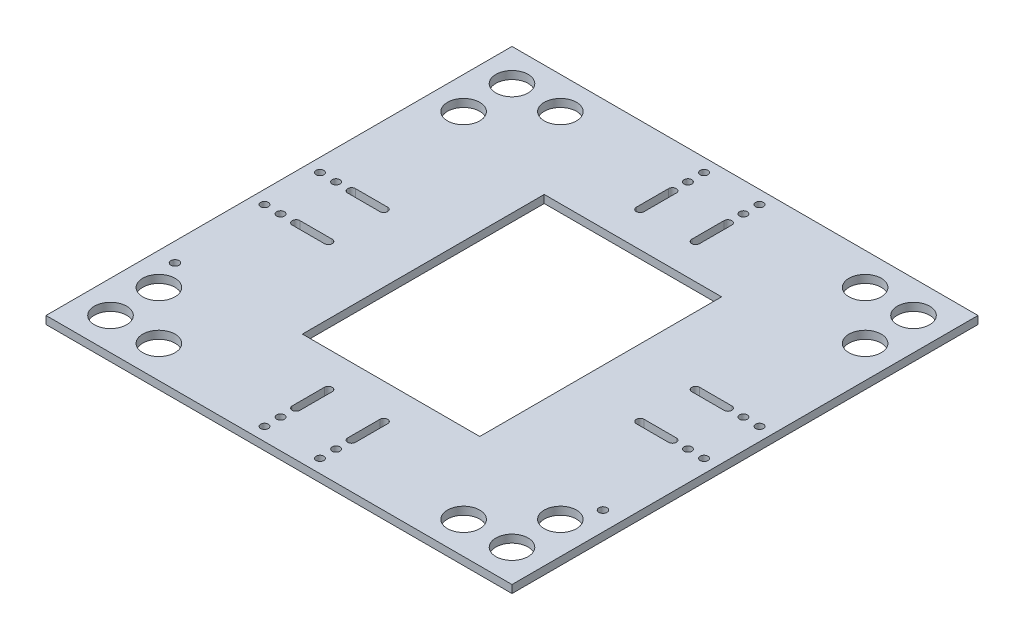
from build123d import *

# Parameters (mm, degrees)
SKETCH3_W           = 183.5200292
SKETCH3_H           = 183.5200292
BOSS_EXTRUDE1_DEPTH = 3.0988
SKETCH4_R           = 1.524
CUT_EXTRUDE1_DEPTH  = 260.555013045
CUT_EXTRUDE2_REACH  = 261.555
SKETCH5_R           = 6.35
SKETCH5_W           = 69.85
SKETCH5_H           = 95.25
SKETCH7_R           = 1.6002
CUT_EXTRUDE6_DEPTH  = 2.54


with BuildPart() as part:
    # Sketch3 → Boss-Extrude1 (new body)
    with BuildSketch(Plane(origin=(0, 0, 0), x_dir=(1, 0, 0), z_dir=(0, 1, 0))):
        with Locations((91.7600146, 91.7600146)):
            Rectangle(SKETCH3_W, SKETCH3_H)
    extrude(amount=BOSS_EXTRUDE1_DEPTH)

    # Sketch4 → Cut-Extrude1 (cut, through all)
    with BuildSketch(Plane(origin=(0, 3.0988, 0), x_dir=(1, 0, 0), z_dir=(0, 1, 0))):
        with Locations(Location((5.200015, 102.6820146, 0), (0, 0, 270))):
            Circle(SKETCH4_R)
        with Locations(Location((11.550015, 102.6820146, 0), (0, 0, 270))):
            Circle(SKETCH4_R)
        with Locations(Location((11.550015, 80.8380146, 0), (0, 0, 90))):
            Circle(SKETCH4_R)
        with Locations(Location((5.200015, 80.8380146, 0), (0, 0, 90))):
            Circle(SKETCH4_R)
        with Locations(Location((178.3200142, 80.8380146, 0), (0, 0, 270))):
            Circle(SKETCH4_R)
        with Locations(Location((171.9700142, 80.8380146, 0), (0, 0, 270))):
            Circle(SKETCH4_R)
        with Locations(Location((171.9700142, 102.6820146, 0), (0, 0, 90))):
            Circle(SKETCH4_R)
        with Locations(Location((178.3200142, 102.6820146, 0), (0, 0, 90))):
            Circle(SKETCH4_R)
        with Locations(Location((80.8380146, 178.3130292, 0), (0, 0, 270))):
            Circle(SKETCH4_R)
        with Locations(Location((80.8380146, 171.9630292, 0), (0, 0, 270))):
            Circle(SKETCH4_R)
        with Locations(Location((102.6820146, 171.9630292, 0), (0, 0, 90))):
            Circle(SKETCH4_R)
        with Locations(Location((102.6820146, 178.3130292, 0), (0, 0, 90))):
            Circle(SKETCH4_R)
        with Locations(Location((102.6820146, 5.207, 0), (0, 0, 270))):
            Circle(SKETCH4_R)
        with Locations(Location((102.6820146, 11.557, 0), (0, 0, 270))):
            Circle(SKETCH4_R)
        with Locations(Location((80.8380146, 11.557, 0), (0, 0, 90))):
            Circle(SKETCH4_R)
        with Locations(Location((80.8380146, 5.207, 0), (0, 0, 90))):
            Circle(SKETCH4_R)
        with BuildLine():
            Line((17.646015, 101.1580146), (30.346015, 101.1580146))
            ThreePointArc((30.346015, 101.1580146), (31.870015, 102.6820146), (30.346015, 104.2060146))
            Line((30.346015, 104.2060146), (17.646015, 104.2060146))
            ThreePointArc((17.646015, 104.2060146), (16.122015, 102.6820146), (17.646015, 101.1580146))
        make_face()
        with BuildLine():
            Line((17.646015, 79.3140146), (30.346015, 79.3140146))
            ThreePointArc((30.346015, 79.3140146), (31.870015, 80.8380146), (30.346015, 82.3620146))
            Line((30.346015, 82.3620146), (17.646015, 82.3620146))
            ThreePointArc((17.646015, 82.3620146), (16.122015, 80.8380146), (17.646015, 79.3140146))
        make_face()
        with BuildLine():
            Line((165.8740142, 82.3620146), (153.1740142, 82.3620146))
            ThreePointArc((153.1740142, 82.3620146), (151.6500142, 80.8380146), (153.1740142, 79.3140146))
            Line((153.1740142, 79.3140146), (165.8740142, 79.3140146))
            ThreePointArc((165.8740142, 79.3140146), (167.3980142, 80.8380146), (165.8740142, 82.3620146))
        make_face()
        with BuildLine():
            Line((165.8740142, 104.2060146), (153.1740142, 104.2060146))
            ThreePointArc((153.1740142, 104.2060146), (151.6500142, 102.6820146), (153.1740142, 101.1580146))
            Line((153.1740142, 101.1580146), (165.8740142, 101.1580146))
            ThreePointArc((165.8740142, 101.1580146), (167.3980142, 102.6820146), (165.8740142, 104.2060146))
        make_face()
        with BuildLine():
            Line((79.3140146, 153.1670292), (79.3140146, 165.8670292))
            ThreePointArc((79.3140146, 165.8670292), (80.8380146, 167.3910292), (82.3620146, 165.8670292))
            Line((82.3620146, 165.8670292), (82.3620146, 153.1670292))
            ThreePointArc((82.3620146, 153.1670292), (80.8380146, 151.6430292), (79.3140146, 153.1670292))
        make_face()
        with BuildLine():
            Line((101.1580146, 153.1670292), (101.1580146, 165.8670292))
            ThreePointArc((101.1580146, 165.8670292), (102.6820146, 167.3910292), (104.2060146, 165.8670292))
            Line((104.2060146, 165.8670292), (104.2060146, 153.1670292))
            ThreePointArc((104.2060146, 153.1670292), (102.6820146, 151.6430292), (101.1580146, 153.1670292))
        make_face()
        with BuildLine():
            Line((104.2060146, 30.353), (104.2060146, 17.653))
            ThreePointArc((104.2060146, 17.653), (102.6820146, 16.129), (101.1580146, 17.653))
            Line((101.1580146, 17.653), (101.1580146, 30.353))
            ThreePointArc((101.1580146, 30.353), (102.6820146, 31.877), (104.2060146, 30.353))
        make_face()
        with BuildLine():
            Line((82.3620146, 30.353), (82.3620146, 17.653))
            ThreePointArc((82.3620146, 17.653), (80.8380146, 16.129), (79.3140146, 17.653))
            Line((79.3140146, 17.653), (79.3140146, 30.353))
            ThreePointArc((79.3140146, 30.353), (80.8380146, 31.877), (82.3620146, 30.353))
        make_face()
    extrude(amount=-CUT_EXTRUDE1_DEPTH, mode=Mode.SUBTRACT)

    # Sketch5 → Cut-Extrude2 (cut, up to next)
    with BuildSketch(Plane(origin=(0, 3.0988, 0), x_dir=(1, 0, 0), z_dir=(0, 1, 0)), mode=Mode.PRIVATE) as cut_extrude2_sk1:
        with Locations(Location((170.8200292, 151.7700292, 0), (0, 0, 90))):
            Circle(SKETCH5_R)
    cut_extrude2_tool1 = extrude(cut_extrude2_sk1.sketch, amount=-CUT_EXTRUDE2_REACH, mode=Mode.PRIVATE) & part.part
    # Sketch5 → Cut-Extrude2 (cut, up to next)
    with BuildSketch(Plane(origin=(0, 3.0988, 0), x_dir=(1, 0, 0), z_dir=(0, 1, 0)), mode=Mode.PRIVATE) as cut_extrude2_sk2:
        with Locations(Location((170.8200292, 170.8200292, 0), (0, 0, 90))):
            Circle(SKETCH5_R)
    cut_extrude2_tool2 = extrude(cut_extrude2_sk2.sketch, amount=-CUT_EXTRUDE2_REACH, mode=Mode.PRIVATE) & part.part
    # Sketch5 → Cut-Extrude2 (cut, up to next)
    with BuildSketch(Plane(origin=(0, 3.0988, 0), x_dir=(1, 0, 0), z_dir=(0, 1, 0)), mode=Mode.PRIVATE) as cut_extrude2_sk3:
        with Locations(Location((151.7700292, 170.8200292, 0), (0, 0, 90))):
            Circle(SKETCH5_R)
    cut_extrude2_tool3 = extrude(cut_extrude2_sk3.sketch, amount=-CUT_EXTRUDE2_REACH, mode=Mode.PRIVATE) & part.part
    # Sketch5 → Cut-Extrude2 (cut, up to next)
    with BuildSketch(Plane(origin=(0, 3.0988, 0), x_dir=(1, 0, 0), z_dir=(0, 1, 0)), mode=Mode.PRIVATE) as cut_extrude2_sk4:
        with Locations(Location((170.8200292, 31.75, 0), (0, 0, 270))):
            Circle(SKETCH5_R)
    cut_extrude2_tool4 = extrude(cut_extrude2_sk4.sketch, amount=-CUT_EXTRUDE2_REACH, mode=Mode.PRIVATE) & part.part
    # Sketch5 → Cut-Extrude2 (cut, up to next)
    with BuildSketch(Plane(origin=(0, 3.0988, 0), x_dir=(1, 0, 0), z_dir=(0, 1, 0)), mode=Mode.PRIVATE) as cut_extrude2_sk5:
        with Locations(Location((12.7, 31.75, 0), (0, 0, 90))):
            Circle(SKETCH5_R)
    cut_extrude2_tool5 = extrude(cut_extrude2_sk5.sketch, amount=-CUT_EXTRUDE2_REACH, mode=Mode.PRIVATE) & part.part
    # Sketch5 → Cut-Extrude2 (cut, up to next)
    with BuildSketch(Plane(origin=(0, 3.0988, 0), x_dir=(1, 0, 0), z_dir=(0, 1, 0)), mode=Mode.PRIVATE) as cut_extrude2_sk6:
        with Locations(Location((12.7, 12.7, 0), (0, 0, 90))):
            Circle(SKETCH5_R)
    cut_extrude2_tool6 = extrude(cut_extrude2_sk6.sketch, amount=-CUT_EXTRUDE2_REACH, mode=Mode.PRIVATE) & part.part
    # Sketch5 → Cut-Extrude2 (cut, up to next)
    with BuildSketch(Plane(origin=(0, 3.0988, 0), x_dir=(1, 0, 0), z_dir=(0, 1, 0)), mode=Mode.PRIVATE) as cut_extrude2_sk7:
        with Locations(Location((31.75, 12.7, 0), (0, 0, 90))):
            Circle(SKETCH5_R)
    cut_extrude2_tool7 = extrude(cut_extrude2_sk7.sketch, amount=-CUT_EXTRUDE2_REACH, mode=Mode.PRIVATE) & part.part
    # Sketch5 → Cut-Extrude2 (cut, up to next)
    with BuildSketch(Plane(origin=(0, 3.0988, 0), x_dir=(1, 0, 0), z_dir=(0, 1, 0)), mode=Mode.PRIVATE) as cut_extrude2_sk8:
        with Locations(Location((151.7700292, 12.7, 0), (0, 0, 270))):
            Circle(SKETCH5_R)
    cut_extrude2_tool8 = extrude(cut_extrude2_sk8.sketch, amount=-CUT_EXTRUDE2_REACH, mode=Mode.PRIVATE) & part.part
    # Sketch5 → Cut-Extrude2 (cut, up to next)
    with BuildSketch(Plane(origin=(0, 3.0988, 0), x_dir=(1, 0, 0), z_dir=(0, 1, 0)), mode=Mode.PRIVATE) as cut_extrude2_sk9:
        with Locations(Location((31.75, 170.8200292, 0), (0, 0, 270))):
            Circle(SKETCH5_R)
    cut_extrude2_tool9 = extrude(cut_extrude2_sk9.sketch, amount=-CUT_EXTRUDE2_REACH, mode=Mode.PRIVATE) & part.part
    # Sketch5 → Cut-Extrude2 (cut, up to next)
    with BuildSketch(Plane(origin=(0, 3.0988, 0), x_dir=(1, 0, 0), z_dir=(0, 1, 0)), mode=Mode.PRIVATE) as cut_extrude2_sk10:
        with Locations(Location((12.7, 170.8200292, 0), (0, 0, 270))):
            Circle(SKETCH5_R)
    cut_extrude2_tool10 = extrude(cut_extrude2_sk10.sketch, amount=-CUT_EXTRUDE2_REACH, mode=Mode.PRIVATE) & part.part
    # Sketch5 → Cut-Extrude2 (cut, up to next)
    with BuildSketch(Plane(origin=(0, 3.0988, 0), x_dir=(1, 0, 0), z_dir=(0, 1, 0)), mode=Mode.PRIVATE) as cut_extrude2_sk11:
        with Locations(Location((12.7, 151.7700292, 0), (0, 0, 270))):
            Circle(SKETCH5_R)
    cut_extrude2_tool11 = extrude(cut_extrude2_sk11.sketch, amount=-CUT_EXTRUDE2_REACH, mode=Mode.PRIVATE) & part.part
    # Sketch5 → Cut-Extrude2 (cut, up to next)
    with BuildSketch(Plane(origin=(0, 3.0988, 0), x_dir=(1, 0, 0), z_dir=(0, 1, 0)), mode=Mode.PRIVATE) as cut_extrude2_sk12:
        with Locations(Location((170.8200292, 12.7, 0), (0, 0, 270))):
            Circle(SKETCH5_R)
    cut_extrude2_tool12 = extrude(cut_extrude2_sk12.sketch, amount=-CUT_EXTRUDE2_REACH, mode=Mode.PRIVATE) & part.part
    # Sketch5 → Cut-Extrude2 (cut, up to next)
    with BuildSketch(Plane(origin=(0, 3.0988, 0), x_dir=(1, 0, 0), z_dir=(0, 1, 0)), mode=Mode.PRIVATE) as cut_extrude2_sk13:
        with Locations((91.7600146, 91.7600146)):
            Rectangle(SKETCH5_W, SKETCH5_H)
    cut_extrude2_tool13 = extrude(cut_extrude2_sk13.sketch, amount=-CUT_EXTRUDE2_REACH, mode=Mode.PRIVATE) & part.part
    add(cut_extrude2_tool1.solids().sort_by_distance((170.820029, 3.0988, -151.770029))[0], mode=Mode.SUBTRACT)
    add(cut_extrude2_tool2.solids().sort_by_distance((170.820029, 3.0988, -170.820029))[0], mode=Mode.SUBTRACT)
    add(cut_extrude2_tool3.solids().sort_by_distance((151.770029, 3.0988, -170.820029))[0], mode=Mode.SUBTRACT)
    add(cut_extrude2_tool4.solids().sort_by_distance((170.820029, 3.0988, -31.75))[0], mode=Mode.SUBTRACT)
    add(cut_extrude2_tool5.solids().sort_by_distance((12.7, 3.0988, -31.75))[0], mode=Mode.SUBTRACT)
    add(cut_extrude2_tool6.solids().sort_by_distance((12.7, 3.0988, -12.7))[0], mode=Mode.SUBTRACT)
    add(cut_extrude2_tool7.solids().sort_by_distance((31.75, 3.0988, -12.7))[0], mode=Mode.SUBTRACT)
    add(cut_extrude2_tool8.solids().sort_by_distance((151.770029, 3.0988, -12.7))[0], mode=Mode.SUBTRACT)
    add(cut_extrude2_tool9.solids().sort_by_distance((31.75, 3.0988, -170.820029))[0], mode=Mode.SUBTRACT)
    add(cut_extrude2_tool10.solids().sort_by_distance((12.7, 3.0988, -170.820029))[0], mode=Mode.SUBTRACT)
    add(cut_extrude2_tool11.solids().sort_by_distance((12.7, 3.0988, -151.770029))[0], mode=Mode.SUBTRACT)
    add(cut_extrude2_tool12.solids().sort_by_distance((170.820029, 3.0988, -12.7))[0], mode=Mode.SUBTRACT)
    add(cut_extrude2_tool13.solids().sort_by_distance((91.760015, 3.0988, -91.760015))[0], mode=Mode.SUBTRACT)

    # Sketch7 → Cut-Extrude6 (cut)
    with BuildSketch(Plane(origin=(0, 3.0988, 0), x_dir=(1, 0, 0), z_dir=(0, 1, 0))):
        with Locations(Location((7.4828146, 43.3120292, 0), (0, 0, 270))):
            Circle(SKETCH7_R)
        with Locations(Location((176.0372146, 43.3120292, 0), (0, 0, 270))):
            Circle(SKETCH7_R)
    extrude(amount=-CUT_EXTRUDE6_DEPTH, mode=Mode.SUBTRACT)


solid = part.part
